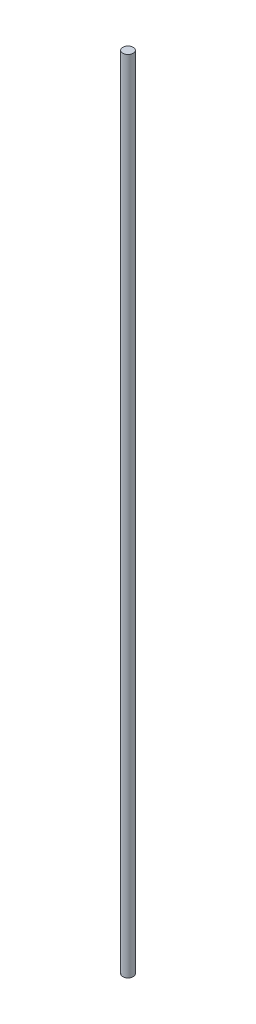
from build123d import *

# Parameters (mm, degrees)
SKETCH1_R           = 4.1
BOSS_EXTRUDE1_DEPTH = 628.71


with BuildPart() as part:
    # Sketch1 → Boss-Extrude1 (new body)
    with BuildSketch(Plane(origin=(0, 0, 0), x_dir=(1, 0, 0), z_dir=(0, 1, 0))):
        with Locations(Location((0, 0, 0), (0, 0, 270))):
            Circle(SKETCH1_R)
    extrude(amount=BOSS_EXTRUDE1_DEPTH)


solid = part.part
